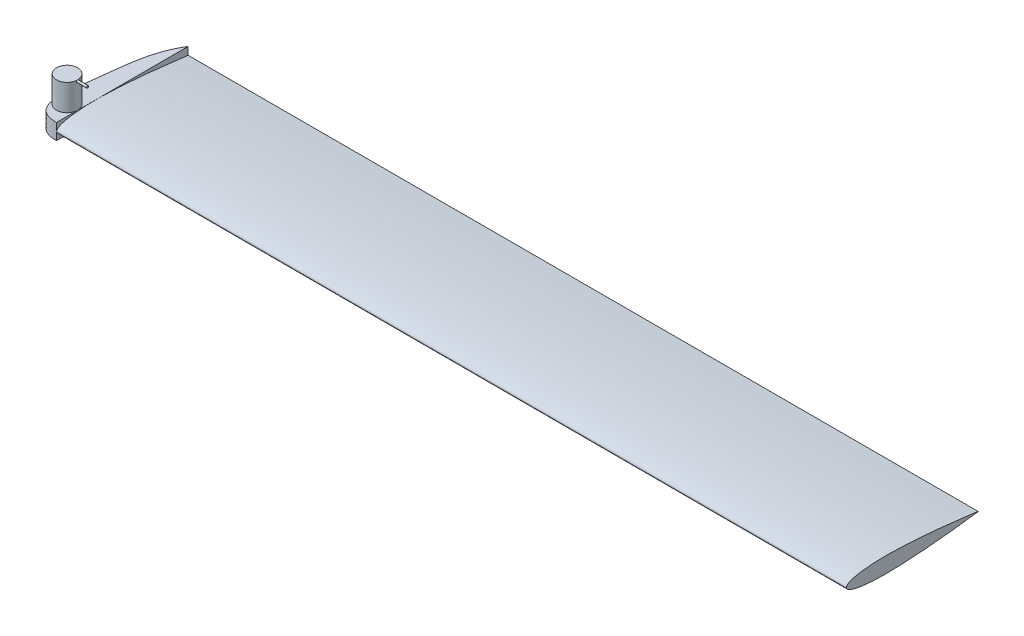
from build123d import *

# Parameters (mm, degrees)
BOSS_EXTRUDE1_DEPTH      = 750
BOSS_EXTRUDE4_DEPTH      = 15
SKETCH3_R                = 10
BOSS_EXTRUDE5_DEPTH      = 25
BOSS_EXTRUDE6_DEPTH      = 9.5
BOSS_EXTRUDE6_DEPTH_BACK = 9.5
SKETCH4_R                = 1


with BuildPart() as part:
    # Sketch1 → Boss-Extrude1 (new body)
    with BuildSketch(Plane(origin=(0, 0, 0), x_dir=(0, 0, -1), z_dir=(1, 0, 0))):
        with BuildLine():
            Line((124.995841149, 7.69748541), (124.995841149, 7.355117962))
            add(Edge.make_bspline(
                [(124.995841149, 7.69748541), (121.54944134, 8.132970798), (115.70786567, 8.871109432), (106.612829463, 10.001168496), (98.776677449, 10.90008096), (91.010430983, 11.718079743), (84.466171166, 12.374421583), (77.123127033, 13.01089191), (70.096902966, 13.661558661), (63.232186969, 14.038262432), (56.951183357, 14.458646485), (50.183054312, 14.744779284), (43.713149432, 14.928847728), (38.016747366, 14.98676945), (31.867108518, 14.964167357), (25.961108401, 14.764171889), (20.418478368, 14.31892281), (16.080893919, 13.902077279), (11.948417441, 13.276680513), (7.872022134, 12.438747868), (4.55145991, 11.481590763), (1.935078283, 10.189615691), (0.419790589, 8.867752598), (-0.116328202, 7.676448045), (0.228543289, 6.575716308), (1.092059769, 5.382828043), (3.121329832, 4.182675807), (5.833945868, 3.122360161), (8.969424846, 2.338039739), (12.454934448, 1.635555066), (16.398041291, 1.057622245), (20.40737347, 0.619305342), (24.940496845, 0.318514105), (28.9969109, 0.097914693), (33.640357675, 0.064950819), (37.619824838, -0.008774002), (42.130231161, 0.0151669), (46.825478609, 0.12809962), (52.059229259, 0.308197083), (57.570273171, 0.566048003), (63.06655694, 0.903534981), (68.78158744, 1.273560104), (74.2410514, 1.701195853), (79.332078991, 2.13196813), (83.765135248, 2.525837795), (88.333862548, 3.014972175), (93.451881908, 3.495491212), (98.448514928, 4.030663182), (103.359945306, 4.559670893), (107.534749069, 5.051051401), (112.036034411, 5.652589328), (116.898948088, 6.205114514), (121.185254011, 6.89818955), (124.034905271, 7.135577505), (124.871587069, 7.326730223), (124.995841149, 7.355117962)],
                knots=[0, 0, 0, 0, 0.040909693, 0.069341075, 0.107932085, 0.133795715, 0.161307297, 0.185385504, 0.220597866, 0.244393633, 0.266343568, 0.294730889, 0.324163188, 0.342565083, 0.361815516, 0.396586444, 0.412117028, 0.427295281, 0.44789639, 0.461301181, 0.476284913, 0.488528163, 0.495261637, 0.499815717, 0.502760785, 0.508369898, 0.516837026, 0.529992215, 0.542688859, 0.55481219, 0.571870003, 0.589595674, 0.60229618, 0.625369139, 0.637420541, 0.65697654, 0.672241267, 0.69053398, 0.712285021, 0.733912638, 0.755503976, 0.777133729, 0.801356586, 0.819993044, 0.837303591, 0.853766864, 0.874103184, 0.897840615, 0.912945775, 0.932278219, 0.947341947, 0.966428856, 0.989896213, 0.998499505, 1, 1, 1, 1], degree=3))
        make_face()
    extrude(amount=BOSS_EXTRUDE1_DEPTH)

    # Sketch2 → Boss-Extrude4 (add)
    with BuildSketch(Plane(origin=(0, 0, 0), x_dir=(1, 0, 0), z_dir=(0, 1, 0))):
        with BuildLine():
            Line((0, 124.995841149), (0, -0.000123715))
            add(Edge.make_bspline(
                [(0, -0.000123715), (-19.650012377, -0.338073724), (-20, 19.999876285)],
                knots=[0, 0, 0, 1, 1, 1], degree=2))
            add(Edge.make_bspline(
                [(-20, 19.999876285), (-20.256491221, 33.605237108), (-15.141746561, 69.220975098), (-12.666672021, 105.011543662), (0, 124.995841149)],
                knots=[0, 0, 0, 0, 0.363918555, 1, 1, 1, 1], degree=3))
        make_face()
    extrude(amount=BOSS_EXTRUDE4_DEPTH)

    # Sketch3 → Boss-Extrude5 (add)
    with BuildSketch(Plane(origin=(0, 15, 0), x_dir=(1, 0, 0), z_dir=(0, 1, 0))):
        with Locations((-10, 20)):
            Circle(SKETCH3_R)
    extrude(amount=BOSS_EXTRUDE5_DEPTH)

    # Sketch4 → Boss-Extrude6 (add, two sides: drawn at the far end of the back side and taken through both)
    with BuildSketch(Plane(origin=(0, 0, 0), x_dir=(0, 0, -1), z_dir=(1, 0, 0)).offset(-BOSS_EXTRUDE6_DEPTH_BACK)):
        with Locations(Location((20, 39, 0), (0, 0, 270))):
            Circle(SKETCH4_R)
    extrude(amount=BOSS_EXTRUDE6_DEPTH + BOSS_EXTRUDE6_DEPTH_BACK)


solid = part.part
